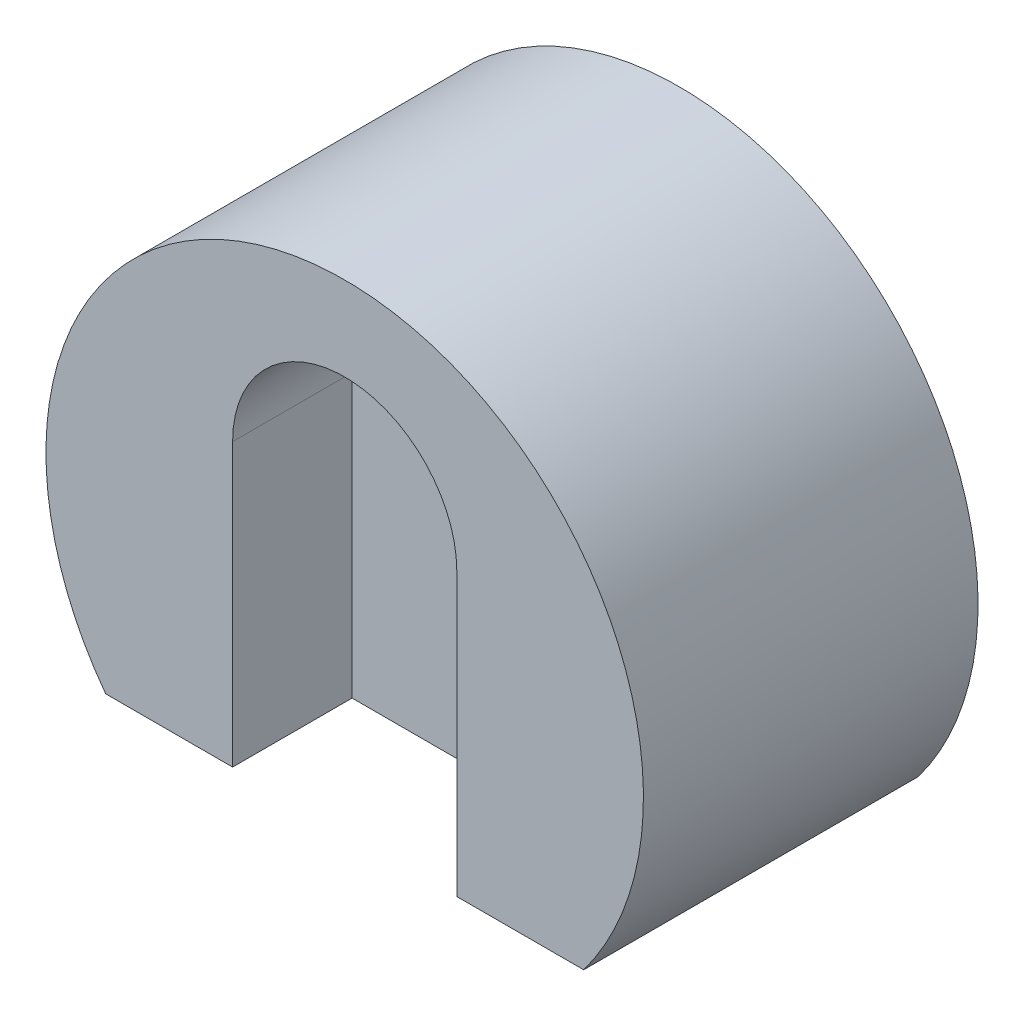
from build123d import *

# Parameters (mm, degrees)
AUFSATZ_LINEAR_AUSTRAGEN1_DEPTH = 5.6
SCHNITT_LINEAR_AUSTRAGEN1_DEPTH = 2


with BuildPart() as part:
    # Skizze1 → Aufsatz-Linear austragen1 (new body)
    with BuildSketch(Plane.XY):
        with BuildLine():
            Line((-4, -3), (4, -3))
            ThreePointArc((4, -3), (0, 5), (-4, -3))
        make_face()
    extrude(amount=-AUFSATZ_LINEAR_AUSTRAGEN1_DEPTH)

    # Skizze2 → Schnitt-Linear austragen1 (cut)
    with BuildSketch(Plane.XY):
        with BuildLine():
            Line((-1.876254768, -1.717667449), (-1.876254768, -3))
            Line((-1.876254768, -3), (1.876254768, -3))
            Line((1.876254768, -3), (1.876254768, -1.717667449))
            Line((1.876254768, -1.717667449), (1.876254768, 1.717667449))
            ThreePointArc((1.876254768, 1.717667449), (0, 3.593922217), (-1.876254768, 1.717667449))
            Line((-1.876254768, 1.717667449), (-1.876254768, -1.717667449))
        make_face()
    extrude(amount=-SCHNITT_LINEAR_AUSTRAGEN1_DEPTH, mode=Mode.SUBTRACT)


solid = part.part
